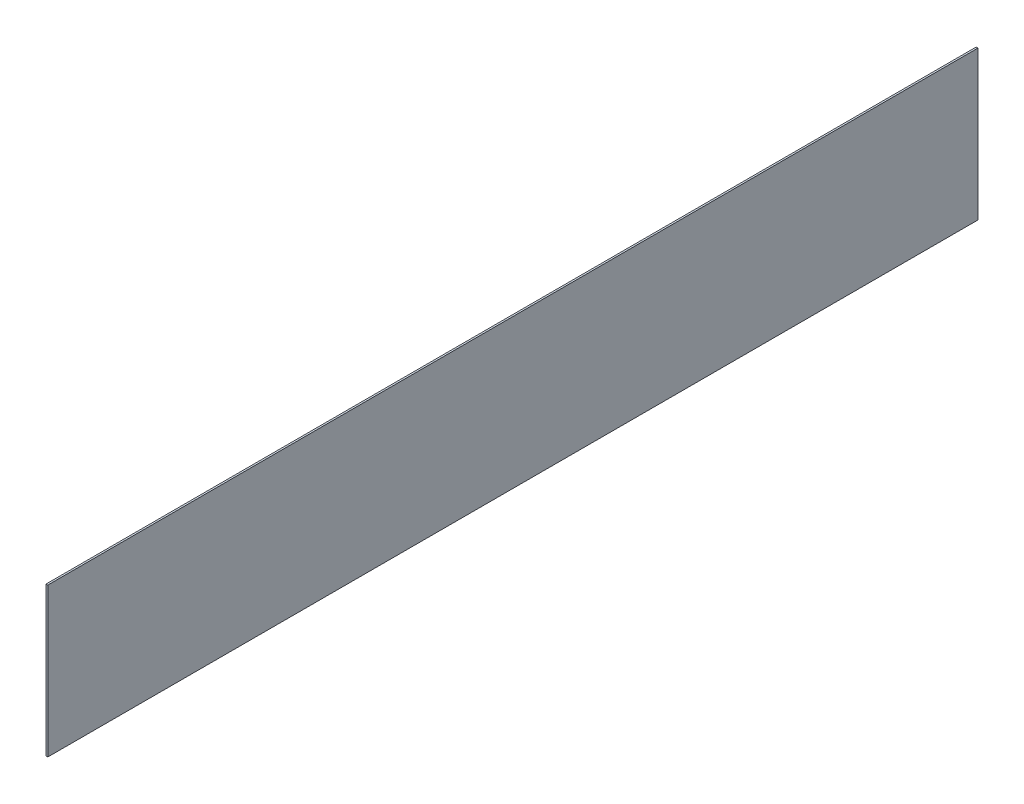
from build123d import *

# Parameters (mm, degrees)
SKETCH1_W           = 825.5
SKETCH1_H           = 132.1435
BOSS_EXTRUDE1_DEPTH = 1.5875


with BuildPart() as part:
    # Sketch1 → Boss-Extrude1 (new body)
    with BuildSketch(Plane(origin=(0, 0, 0), x_dir=(0, 0, -1), z_dir=(1, 0, 0))):
        Rectangle(SKETCH1_W, SKETCH1_H)
    extrude(amount=BOSS_EXTRUDE1_DEPTH)


solid = part.part
